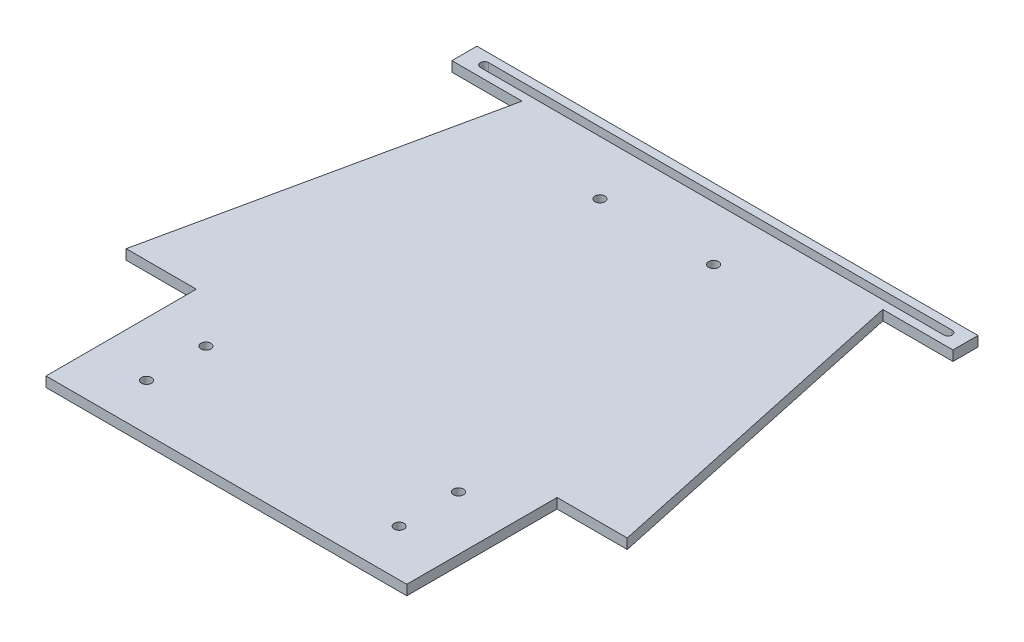
from build123d import *

# Parameters (mm, degrees)
ESQUISSE1_R        = 2
BOSS_EXTRU_1_DEPTH = 4


with BuildPart() as part:
    # Esquisse1 → Boss.-Extru.1 (new body)
    with BuildSketch(Plane(origin=(0, 0, 0), x_dir=(1, 0, 0), z_dir=(0, 1, 0))):
        Polygon((0, 0), (28, 0), (0, -130), (28, -130), (28, -190), (172, -190), (172, -130), (200, -130), (172, 0), (200, 0), (200, 10), (0, 10), align=None)
        with Locations(Location((49.582205252, -147.769246608, 0), (0, 0, 270))):
            Circle(ESQUISSE1_R, mode=Mode.SUBTRACT)
        with Locations(Location((49.582205252, -171.460126827, 0), (0, 0, 270))):
            Circle(ESQUISSE1_R, mode=Mode.SUBTRACT)
        with Locations(Location((77.305575721, -18.22549733, 0), (0, 0, 270))):
            Circle(ESQUISSE1_R, mode=Mode.SUBTRACT)
        with Locations(Location((150.417794748, -171.460126827, 0), (0, 0, 90))):
            Circle(ESQUISSE1_R, mode=Mode.SUBTRACT)
        with Locations(Location((150.417794748, -147.769246608, 0), (0, 0, 90))):
            Circle(ESQUISSE1_R, mode=Mode.SUBTRACT)
        with Locations(Location((122.694424279, -18.22549733, 0), (0, 0, 90))):
            Circle(ESQUISSE1_R, mode=Mode.SUBTRACT)
        with BuildLine():
            Line((8.045765112, 6.656458485), (193.045765112, 6.656458485))
            ThreePointArc((193.045765112, 6.656458485), (194.702223597, 5), (193.045765112, 3.343541515))
            Line((193.045765112, 3.343541515), (8.045765112, 3.343541515))
            ThreePointArc((8.045765112, 3.343541515), (6.389306627, 5), (8.045765112, 6.656458485))
        make_face(mode=Mode.SUBTRACT)
    extrude(amount=BOSS_EXTRU_1_DEPTH)


solid = part.part
